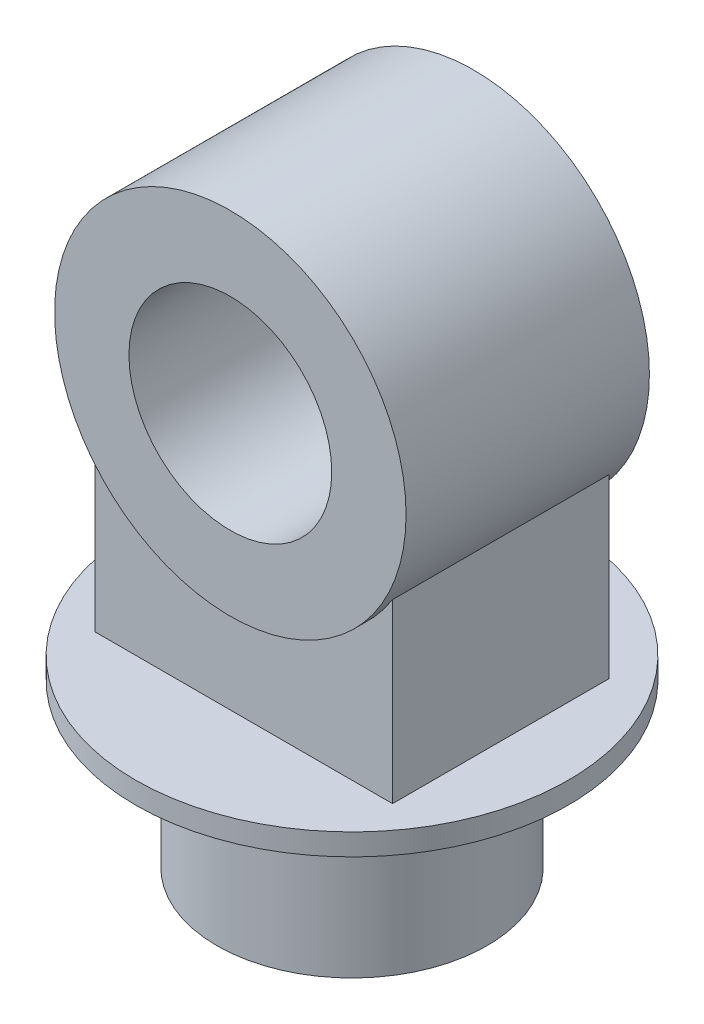
from build123d import *

# Parameters (mm, degrees)
SKETCH1_R                = 100
BOSS_EXTRUDE3_DEPTH      = 120
SKETCH4_R                = 160
BOSS_EXTRUDE4_DEPTH      = 16
SKETCH5_R                = 130
SKETCH5_R_2              = 75
BOSS_EXTRUDE5_DEPTH      = 90
BOSS_EXTRUDE6_REACH      = 402.125
BOSS_EXTRUDE6_END_RADIUS = 130
SKETCH6_W                = 220
SKETCH6_H                = 160


with BuildPart() as part:
    # Sketch1 → Boss-Extrude3 (new body)
    with BuildSketch(Plane(origin=(0, 0, 0), x_dir=(1, 0, 0), z_dir=(0, 1, 0))):
        with Locations(Location((0, 0, 0), (0, 0, 270))):
            Circle(SKETCH1_R)
    extrude(amount=BOSS_EXTRUDE3_DEPTH)

    # Sketch4 → Boss-Extrude4 (add)
    with BuildSketch(Plane(origin=(0, 120, 0), x_dir=(1, 0, 0), z_dir=(0, 1, 0))):
        with Locations(Location((0, 0, 0), (0, 0, 270))):
            Circle(SKETCH4_R)
    extrude(amount=BOSS_EXTRUDE4_DEPTH)



with BuildPart() as body_2:
    # Sketch5 → Boss-Extrude5 (new, symmetric)
    with BuildSketch(Plane.XY):
        with Locations(Location((0, 336, 0), (0, 0, 180))):
            Circle(SKETCH5_R)
        with Locations(Location((0, 336, 0), (0, 0, 180))):
            Circle(SKETCH5_R_2, mode=Mode.SUBTRACT)
    extrude(amount=BOSS_EXTRUDE5_DEPTH, both=True)


with BuildPart() as part_1:
    add(part.part)

    add(body_2.part)  # Boss-Extrude6 merges body 2
    # Boss-Extrude6: up to this cylinder (the profile starts outside it)
    boss_extrude6_end = Plane(origin=(0, 336, 0), z_dir=(0, 0, -1)) * Cylinder(BOSS_EXTRUDE6_END_RADIUS, 1065.25, mode=Mode.PRIVATE)
    # Sketch6 → Boss-Extrude6 (add, up to the surface)
    with BuildSketch(Plane(origin=(0, 136, 0), x_dir=(1, 0, 0), z_dir=(0, 1, 0)), mode=Mode.PRIVATE) as boss_extrude6_sk1:
        Rectangle(SKETCH6_W, SKETCH6_H)
    boss_extrude6_tool1 = extrude(boss_extrude6_sk1.sketch, amount=BOSS_EXTRUDE6_REACH, mode=Mode.PRIVATE) - boss_extrude6_end
    add(boss_extrude6_tool1.solids().sort_by_distance((0, 136, 0))[0])


solid = part_1.part
